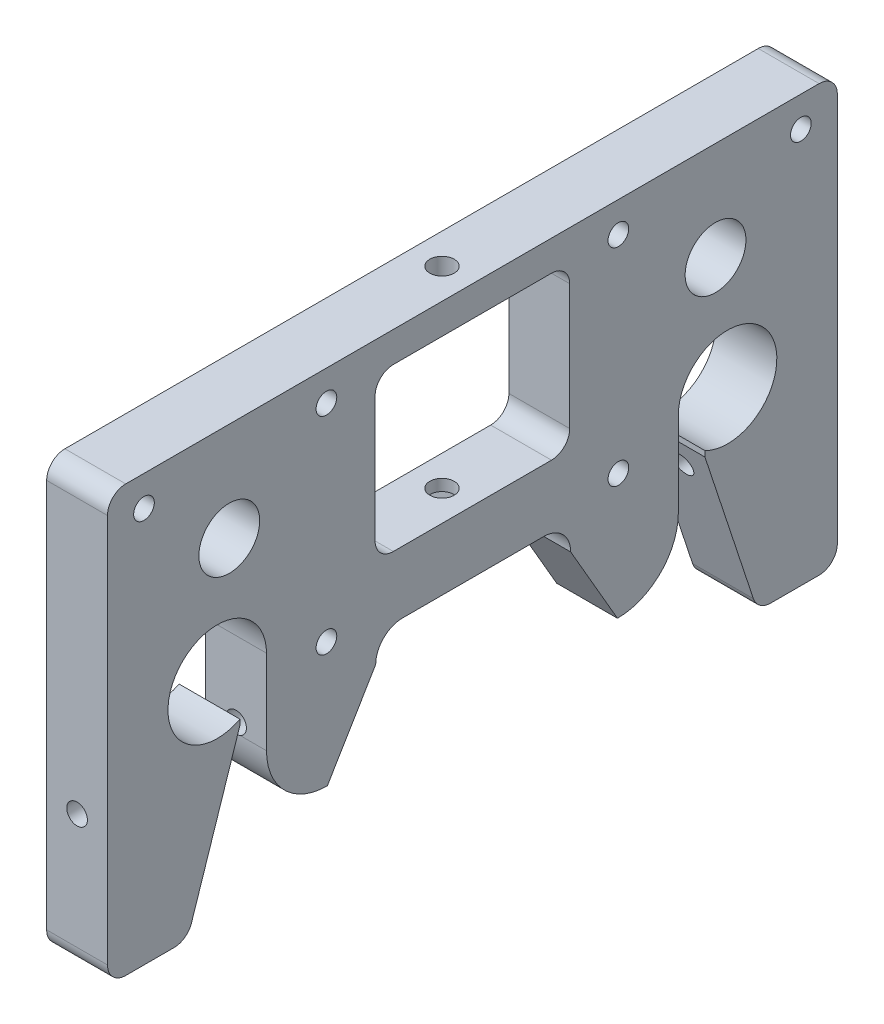
from build123d import *

# Parameters (mm, degrees)
SKETCH_1_R          = 1.7
EXTRUDE_1_DEPTH     = 10
CUT_EXTRUDE_1_DEPTH = 37
SKETCH_3_W          = 3
SKETCH_3_H          = 5.795399196
SKETCH_3_W_2        = 5.804634465
SKETCH_3_H_2        = 3.015219691
SKETCH_3_H_3        = 5.79316294
CUT_EXTRUDE_2_DEPTH = 8
SKETCH_5_R          = 1.7
CUT_EXTRUDE_3_DEPTH = 35
CUT_EXTRUDE_START   = -35
SKETCH_6_R          = 1.7
CUT_EXTRUDE_4_DEPTH = 35
CUT_EXTRUDE_5_DEPTH = 10
SKETCH_9_R          = 5
CUT_EXTRUDE_6_DEPTH = 10


with BuildPart() as part:
    # Эскиз1 → Бобышка-Вытянуть1 (new body)
    with BuildSketch(Plane(origin=(0, 0, 0), x_dir=(0, 0, -1), z_dir=(1, 0, 0))):
        with BuildLine():
            Line((3, 0), (10.95312335, 0))
            ThreePointArc((10.95312335, 0), (12.711116168, 0.569061652), (13.802171454, 2.060359164))
            Line((13.802171454, 2.060359164), (21.766885307, 26.20985548))
            Line((21.766885307, 26.20985548), (21.766885307, 27.126272908))
            ThreePointArc((21.766885307, 27.126272908), (11.12679914, 38.53238769), (26.145937625, 34.320931027))
            Line((26.145937625, 34.320931027), (26.145765698, 20.433139819))
            ThreePointArc((26.145765698, 20.433139819), (29.074654117, 13.361991979), (36.145765697, 10.433016021))
            Line((36.145765697, 10.433016021), (83.854234303, 10.433016021))
            ThreePointArc((83.854234303, 10.433016021), (90.925345883, 13.361991979), (93.854234302, 20.433139819))
            Line((93.854234302, 20.433139819), (93.854062375, 34.320931027))
            ThreePointArc((93.854062375, 34.320931027), (108.87320086, 38.53238769), (98.233114693, 27.126272908))
            Line((98.233114693, 27.126272908), (98.233114693, 26.20985548))
            Line((98.233114693, 26.20985548), (106.197828546, 2.060359164))
            ThreePointArc((106.197828546, 2.060359164), (107.288883832, 0.569061652), (109.04687665, 0))
            Line((109.04687665, 0), (117, 0))
            ThreePointArc((117, 0), (119.121320344, 0.878679656), (120, 3))
            Line((120, 3), (120, 67))
            ThreePointArc((120, 67), (119.121320344, 69.121320344), (117, 70))
            Line((117, 70), (3, 70))
            ThreePointArc((3, 70), (0.878679656, 69.121320344), (0, 67))
            Line((0, 67), (0, 3))
            ThreePointArc((0, 3), (0.878679656, 0.878679656), (3, 0))
        make_face()
        with Locations((36, 65)):
            Circle(SKETCH_1_R, mode=Mode.SUBTRACT)
        with Locations((6, 65)):
            Circle(SKETCH_1_R, mode=Mode.SUBTRACT)
        with Locations((36, 31)):
            Circle(SKETCH_1_R, mode=Mode.SUBTRACT)
        with Locations((84, 31)):
            Circle(SKETCH_1_R, mode=Mode.SUBTRACT)
        with Locations((84, 65)):
            Circle(SKETCH_1_R, mode=Mode.SUBTRACT)
        with Locations((114, 65)):
            Circle(SKETCH_1_R, mode=Mode.SUBTRACT)
        with BuildLine():
            Line((47, 65), (73, 65))
            ThreePointArc((73, 65), (75.121320344, 64.121320344), (76, 62))
            Line((76, 62), (76, 41.380344056))
            ThreePointArc((76, 41.380344056), (75.121320344, 39.259023712), (73, 38.380344056))
            Line((73, 38.380344056), (47, 38.380344056))
            ThreePointArc((47, 38.380344056), (44.878679656, 39.259023712), (44, 41.380344056))
            Line((44, 41.380344056), (44, 62))
            ThreePointArc((44, 62), (44.878679656, 64.121320344), (47, 65))
        make_face(mode=Mode.SUBTRACT)
        with BuildLine():
            Line((48.512942473, 28.14808317), (71.745561711, 28.14808317))
            ThreePointArc((71.745561711, 28.14808317), (76.161679417, 23.731965464), (71.745561711, 19.315847758))
            Line((71.745561711, 19.315847758), (48.512942473, 19.315847758))
            ThreePointArc((48.512942473, 19.315847758), (44.096824767, 23.731965464), (48.512942473, 28.14808317))
        make_face(mode=Mode.SUBTRACT)
    extrude(amount=EXTRUDE_1_DEPTH)

    # Эскиз2 → Вырез-Вытянуть1 (cut)
    with BuildSketch(Plane(origin=(0, 70, 0), x_dir=(1, 0, 0), z_dir=(0, 1, 0))):
        with BuildLine():
            ThreePointArc((7, 60), (6.414213562, 61.414213562), (5, 62))
            Line((5, 62), (5, 60))
            Line((5, 60), (7, 60))
        make_face()
        with BuildLine():
            Line((5, 60), (5, 62))
            ThreePointArc((5, 62), (3.585786438, 58.585786438), (7, 60))
            Line((7, 60), (5, 60))
        make_face()
    extrude(amount=-CUT_EXTRUDE_1_DEPTH, mode=Mode.SUBTRACT)

    # Эскиз3 → Вырез-Вытянуть2 (cut)
    with BuildSketch(Plane.ZY):
        with Locations((-89.477143784, 21.994873796)):
            Rectangle(SKETCH_3_W, SKETCH_3_H)
        with Locations((-60.018321185, 34.987499707)):
            Rectangle(SKETCH_3_W_2, SKETCH_3_H_2)
        with Locations((-30.522856216, 21.995572621)):
            Rectangle(SKETCH_3_W, SKETCH_3_H_3)
    extrude(amount=-CUT_EXTRUDE_2_DEPTH, mode=Mode.SUBTRACT)

    # Эскиз5 → Вырез-Вытянуть3 (cut)
    with BuildSketch(Plane(origin=(0, 0, -120), x_dir=(-1, 0, 0), z_dir=(0, 0, -1))):
        with Locations(Location((-5, 22, 0), (0, 0, 292.826701249))):
            Circle(SKETCH_5_R)
    extrude(amount=-CUT_EXTRUDE_3_DEPTH, mode=Mode.SUBTRACT)

    # Эскиз6 → Вырез-Вытянуть4 (cut)
    with BuildSketch(Plane.XY.offset(CUT_EXTRUDE_START)):
        with Locations(Location((5, 22, 0), (0, 0, 247.173298751))):
            Circle(SKETCH_6_R)
    extrude(amount=CUT_EXTRUDE_4_DEPTH, mode=Mode.SUBTRACT)

    # Эскиз7 → Вырез-Вытянуть5 (cut)
    with BuildSketch(Plane.ZY):
        Polygon((-76.161679417, 23.731965464), (-83.854234303, 10.433016021), (-36.145765697, 10.433016021), (-44.096824767, 23.731965464), align=None)
    extrude(amount=-CUT_EXTRUDE_5_DEPTH, mode=Mode.SUBTRACT)

    # Эскиз9 → Вырез-Вытянуть6 (cut)
    with BuildSketch(Plane.ZY):
        with Locations((-99.973969782, 53.749400687)):
            Circle(SKETCH_9_R)
        with Locations((-20.026030218, 53.749400687)):
            Circle(SKETCH_9_R)
    extrude(amount=-CUT_EXTRUDE_6_DEPTH, mode=Mode.SUBTRACT)


solid = part.part
